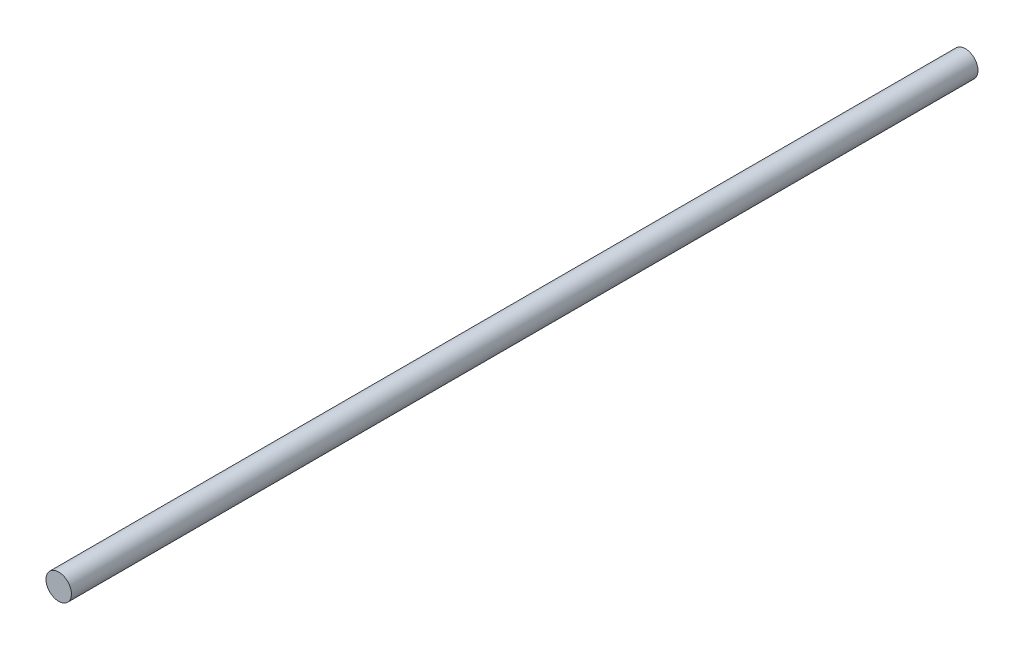
from build123d import *

# Parameters (mm, degrees)
ESQUISSE1_R        = 2.105
BOSS_EXTRU_1_DEPTH = 150


with BuildPart() as part:
    # Esquisse1 → Boss.-Extru.1 (new body)
    with BuildSketch(Plane.XY):
        Circle(ESQUISSE1_R)
    extrude(amount=BOSS_EXTRU_1_DEPTH)


solid = part.part
